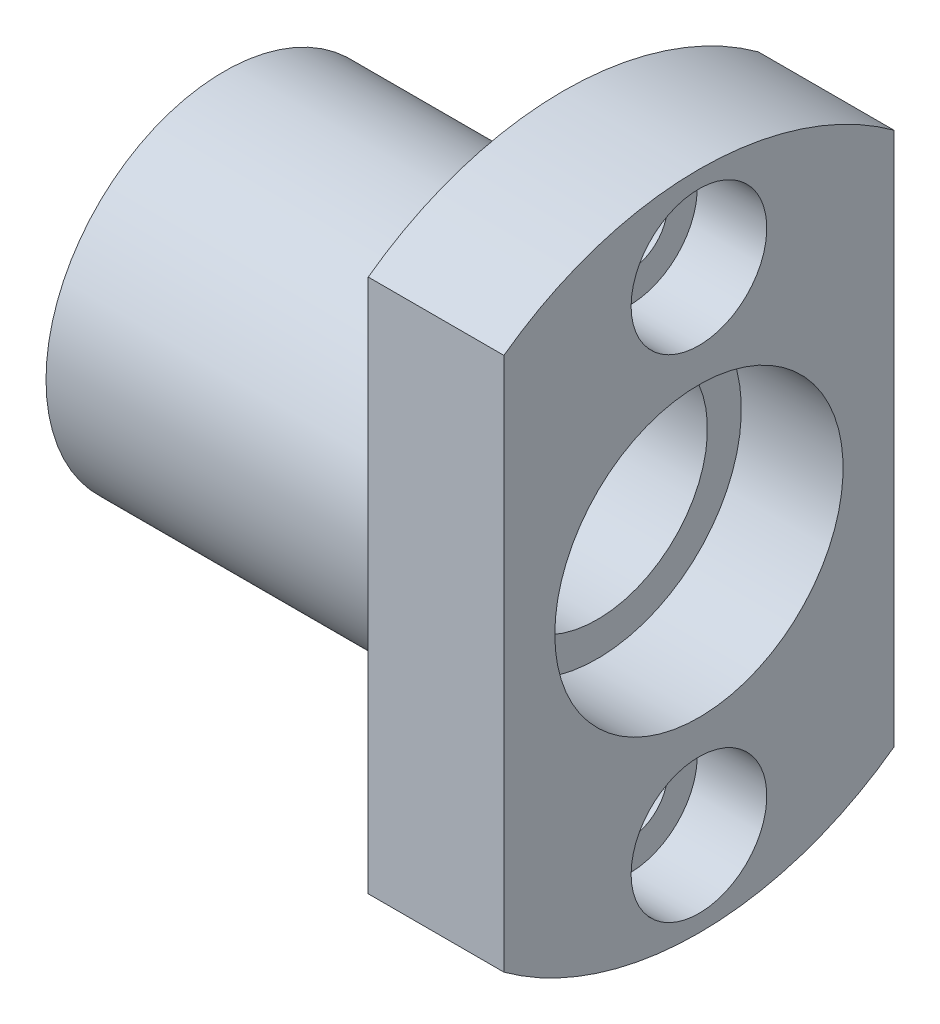
from build123d import *

# Parameters (mm, degrees)
SKETCH_4_R          = 100
SKETCH_4_W          = 23
SKETCH_4_H          = 39
CUT_EXTRUDE_1_DEPTH = 8


with BuildPart() as part:
    # ｽｹｯﾁ1 → 回転1 (revolve)
    with BuildSketch(Plane.XY, mode=Mode.PRIVATE) as revolve_1_sk:
        Polygon((-28, 8.5), (-22, 8.5), (-22, 6.5), (-6, 6.5), (-6, 8.5), (0, 8.5), (0, 19.5), (-8, 19.5), (-8, 10.5), (-28, 10.5), align=None)
    revolve(revolve_1_sk.sketch.rotate(Axis((0, 0, 0), (-1, 0, 0)), 270), axis=Axis((0, 0, 0), (-1, 0, 0)))

    # ｽｹｯﾁ2 → ｶｯﾄ - 回転1 (revolve, cut)
    with BuildSketch(Plane.XY, mode=Mode.PRIVATE) as cut_revolve_1_sk:
        Polygon((-8, 14.5), (-8, 16.75), (-4.1, 16.75), (-4.1, 18.5), (0, 18.5), (0, 14.5), align=None)
    revolve(cut_revolve_1_sk.sketch.rotate(Axis((0, 14.5, 0), (-1, 0, 0)), 270), axis=Axis((0, 14.5, 0), (-1, 0, 0)), mode=Mode.SUBTRACT)

    # ｽｹｯﾁ3 → ｶｯﾄ - 回転2 (revolve, cut)
    with BuildSketch(Plane.XY, mode=Mode.PRIVATE) as cut_revolve_2_sk:
        Polygon((-8, -14.5), (-8, -12.25), (-4.1, -12.25), (-4.1, -10.5), (0, -10.5), (0, -14.5), align=None)
    revolve(cut_revolve_2_sk.sketch.rotate(Axis((0, -14.5, 0), (-1, 0, 0)), 270), axis=Axis((0, -14.5, 0), (-1, 0, 0)), mode=Mode.SUBTRACT)

    # ｽｹｯﾁ4 → ｶｯﾄ - 押し出し1 (cut)
    with BuildSketch(Plane(origin=(0, 0, 0), x_dir=(0, 0, -1), z_dir=(1, 0, 0))):
        Circle(SKETCH_4_R)
        Rectangle(SKETCH_4_W, SKETCH_4_H, mode=Mode.SUBTRACT)
    extrude(amount=-CUT_EXTRUDE_1_DEPTH, mode=Mode.SUBTRACT)


solid = part.part
